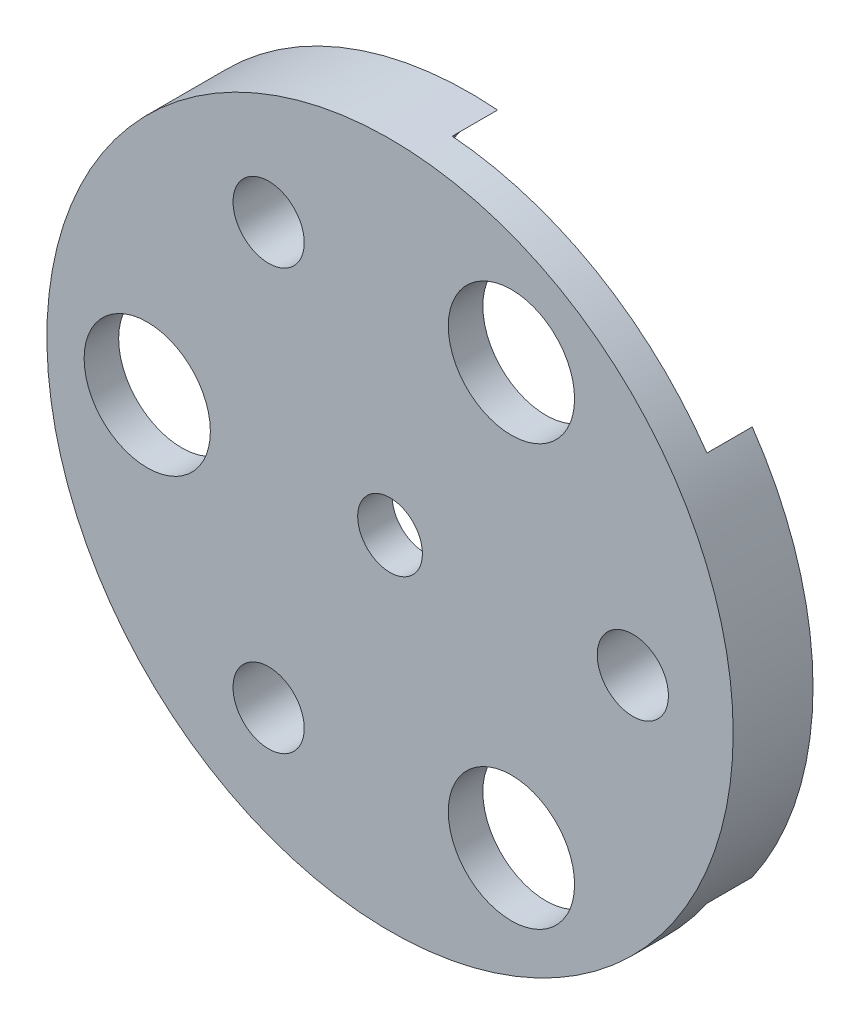
from build123d import *

# Parameters (mm, degrees)
SKETCH1_R           = 15.9
SKETCH1_R_2         = 1.65
SKETCH1_R_3         = 2.925
SKETCH1_R_4         = 1.5
BOSS_EXTRUDE1_DEPTH = 3.7
SKETCH2_R           = 7.347175161
SKETCH2_R_2         = 7.491995358
CUT_EXTRUDE1_DEPTH  = 2.1


with BuildPart() as part:
    # Sketch1 → Boss-Extrude1 (new body)
    with BuildSketch(Plane.XY):
        with Locations((169.819947444, 173.617651357)):
            Circle(SKETCH1_R)
        with Locations((181.069947444, 173.617651357)):
            Circle(SKETCH1_R_2, mode=Mode.SUBTRACT)
        with Locations((158.569947444, 173.617651357)):
            Circle(SKETCH1_R_3, mode=Mode.SUBTRACT)
        with Locations((164.194947444, 163.874865564)):
            Circle(SKETCH1_R_2, mode=Mode.SUBTRACT)
        with Locations((164.194947444, 183.360437149)):
            Circle(SKETCH1_R_2, mode=Mode.SUBTRACT)
        with Locations((175.444947444, 183.360437149)):
            Circle(SKETCH1_R_3, mode=Mode.SUBTRACT)
        with Locations((175.444947444, 163.874865564)):
            Circle(SKETCH1_R_3, mode=Mode.SUBTRACT)
        with Locations((169.819947444, 173.617651357)):
            Circle(SKETCH1_R_4, mode=Mode.SUBTRACT)
    extrude(amount=BOSS_EXTRUDE1_DEPTH)

    # Sketch2 → Cut-Extrude1 (cut)
    with BuildSketch(Plane(origin=(0, 0, 0), x_dir=(-1, 0, 0), z_dir=(0, 0, -1))):
        with Locations((-169.819947444, 173.617651357)):
            Circle(SKETCH2_R)
        with Locations((-158.569947444, 173.617651357)):
            Circle(SKETCH2_R_2)
        with Locations((-175.444947444, 163.874865564)):
            Circle(SKETCH2_R_2)
        with Locations((-175.444947444, 183.360437149)):
            Circle(SKETCH2_R_2)
    extrude(amount=-CUT_EXTRUDE1_DEPTH, mode=Mode.SUBTRACT)


solid = part.part
